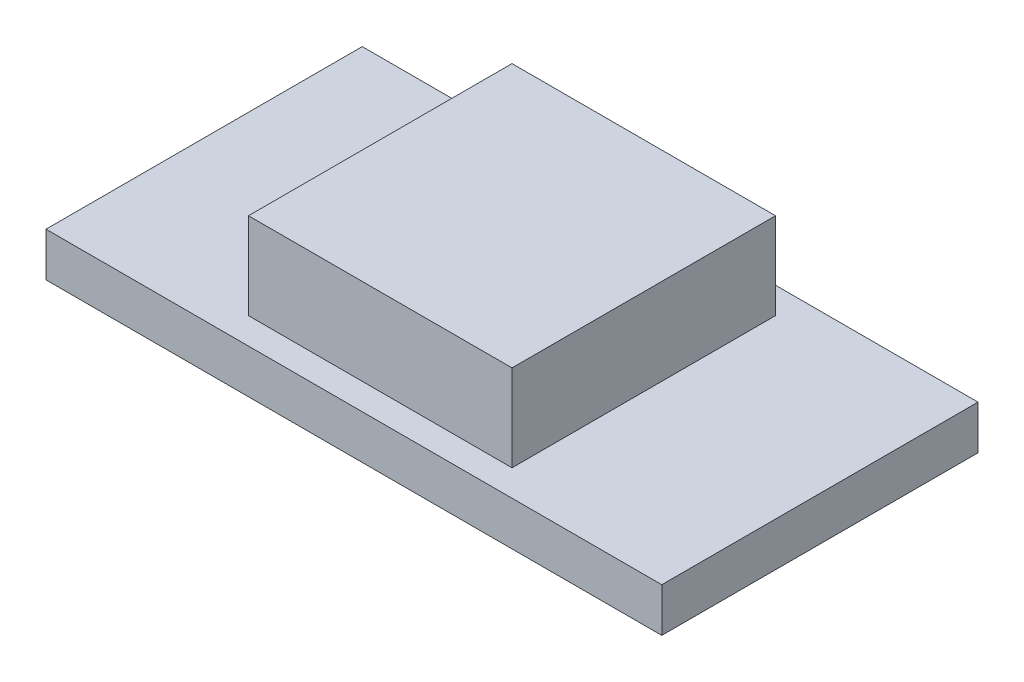
from build123d import *

# Parameters (mm, degrees)
SKETCH_1_W      = 70.1
SKETCH_1_H      = 36
EXTRUDE_1_DEPTH = 5
SKETCH_2_W      = 30
SKETCH_2_H      = 30
EXTRUDE_2_DEPTH = 9.85


with BuildPart() as part:
    # 草圖1 → 填料-伸長1 (new body)
    with BuildSketch(Plane(origin=(0, 0, 0), x_dir=(1, 0, 0), z_dir=(0, 1, 0))):
        Rectangle(SKETCH_1_W, SKETCH_1_H)
    extrude(amount=EXTRUDE_1_DEPTH)

    # 草圖2 → 填料-伸長2 (add)
    with BuildSketch(Plane(origin=(0, 5, 0), x_dir=(1, 0, 0), z_dir=(0, 1, 0))):
        Rectangle(SKETCH_2_W, SKETCH_2_H)
    extrude(amount=EXTRUDE_2_DEPTH)


solid = part.part
